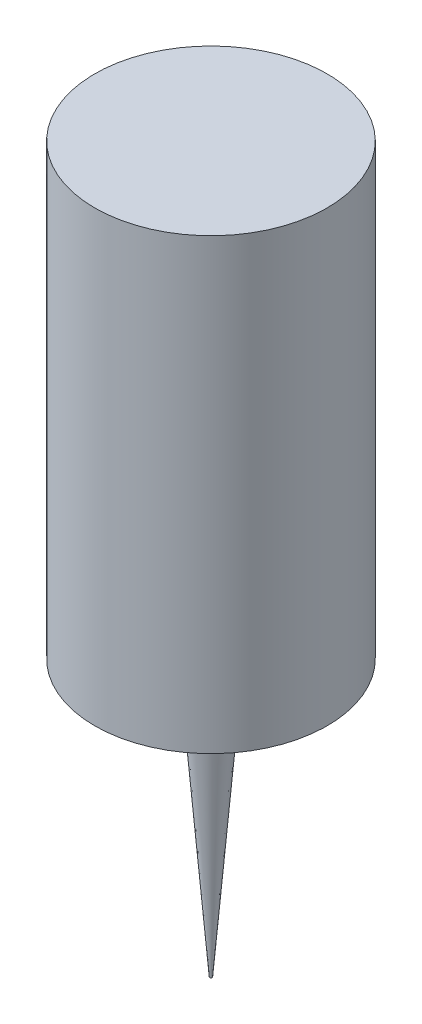
from build123d import *

# Parameters (mm, degrees)
SKETCH1_R           = 2.54
BOSS_EXTRUDE1_DEPTH = 9.8044


with BuildPart() as part:
    # Sketch1 → Boss-Extrude1 (new body)
    with BuildSketch(Plane(origin=(0, 0, 0), x_dir=(1, 0, 0), z_dir=(0, 1, 0))):
        Circle(SKETCH1_R)
    extrude(amount=BOSS_EXTRUDE1_DEPTH)

    # Sketch2 → Revolve1 (revolve)
    with BuildSketch(Plane.XY):
        with BuildLine():
            Line((0, -6.033211953), (0, 0))
            Line((0, 0), (-0.508, 0))
            Line((-0.508, 0), (-0.026066934, -6.024163324))
            ThreePointArc((-0.026066934, -6.024163324), (-0.013796401, -6.030885469), (0, -6.033211953))
        make_face()
    revolve(axis=Axis((0, 0, 0), (0, -1, 0)))


solid = part.part
